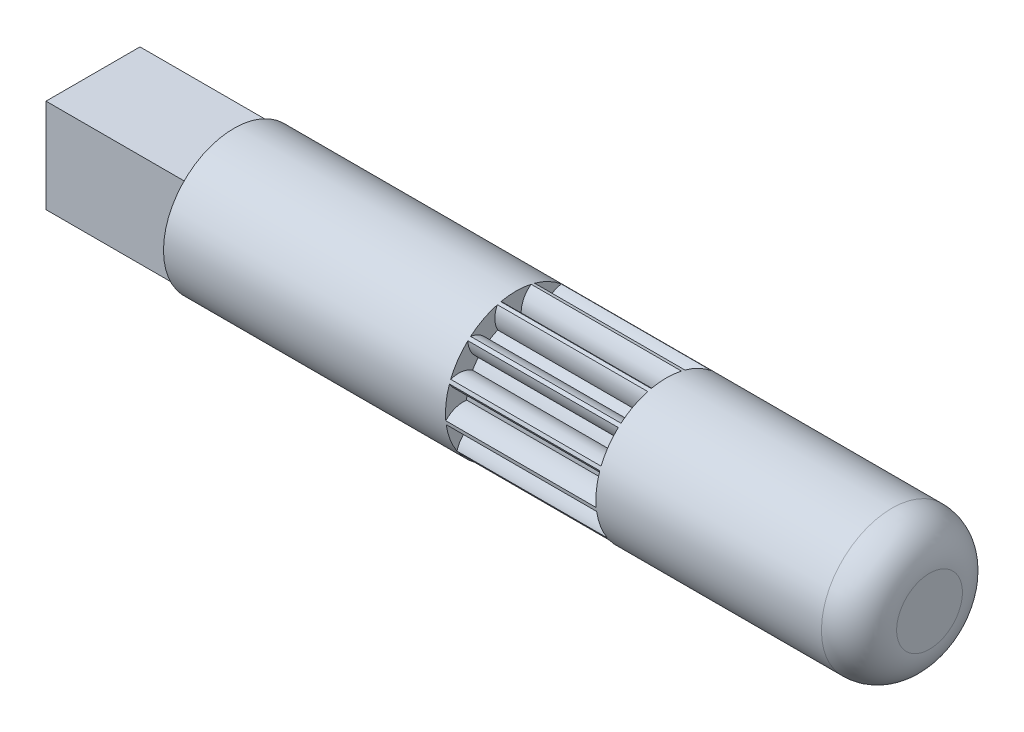
from build123d import *
from build123d.topology import SkipClean

# Parameters (mm, degrees)
BASPROSKE_W         = 8
BASPROSKE_H         = 3.75
TOOTHCUT_DEPTH      = 10.59817691
TEETHCUTS_COUNT     = 13
TEETHCUTS_ANGLE     = 332.307692308
BORSKE_R            = 0.4
BORE_DEPTH          = 50.0000508
SKETCH3_R           = 3.75
BOSS_EXTRUDE3_DEPTH = 15
SKETCH4_W           = 5
SKETCH4_H           = 5
BOSS_EXTRUDE4_DEPTH = 7.5
BOSS_EXTRUDE5_START = 14
SKETCH5_R           = 3.75
BOSS_EXTRUDE5_DEPTH = 14
FILLET1_R           = 2
SKETCH8_R           = 1.303262777
BOSS_EXTRUDE8_DEPTH = 30


with BuildPart() as part:
    # BasProSke → Base-Revolve (revolve)
    with BuildSketch(Plane(origin=(0, 0, 0), x_dir=(1, 0, 0), z_dir=(0, 1, 0))):
        with Locations((4, 1.875)):
            Rectangle(BASPROSKE_W, BASPROSKE_H)
    revolve(axis=Axis((-10, 0, 0), (1, 0, 0)))

    # TooCutSke → ToothCut (cut, through all)
    with BuildSketch(Plane(origin=(0, 0, 0), x_dir=(0, 0, -1), z_dir=(1, 0, 0))):
        with BuildLine():
            ThreePointArc((0.275247387, 2.609523879), (0, 2.624), (-0.275247387, 2.609523879))
            ThreePointArc((-0.275247387, 2.609523879), (-0.421084752, 3.214694797), (-0.831556081, 3.682683756))
            ThreePointArc((-0.831556081, 3.682683756), (0, 3.7754), (0.831556081, 3.682683756))
            ThreePointArc((0.831556081, 3.682683756), (0.421084752, 3.214694797), (0.275247387, 2.609523879))
        make_face()
    toothcut = extrude(amount=TOOTHCUT_DEPTH, mode=Mode.SUBTRACT)

    # TeethCuts: ToothCut ×13 about axis
    teethcuts_axis = Axis((-10, 0, 0), (1, 0, 0))
    for i in range(1, TEETHCUTS_COUNT):
        add(toothcut.rotate(teethcuts_axis, i * TEETHCUTS_ANGLE / (TEETHCUTS_COUNT - 1)), mode=Mode.SUBTRACT)

    # BorSke → Bore (cut, symmetric)
    with BuildSketch(Plane(origin=(0, 0, 0), x_dir=(0, 0, -1), z_dir=(1, 0, 0))):
        Circle(BORSKE_R)
    extrude(amount=BORE_DEPTH, both=True, mode=Mode.SUBTRACT)

    # Sketch3 → Boss-Extrude3 (add)
    with SkipClean():  # the faces are left unmerged after this step: merging them gives an invalid solid
        with BuildSketch(Plane.ZY):
            Circle(SKETCH3_R)
        extrude(amount=BOSS_EXTRUDE3_DEPTH)

    # Sketch4 → Boss-Extrude4 (add)
    with SkipClean():  # the faces are left unmerged after this step: merging them gives an invalid solid
        with BuildSketch(Plane.ZY.offset(15)):
            Rectangle(SKETCH4_W, SKETCH4_H)
        extrude(amount=BOSS_EXTRUDE4_DEPTH)

    # Sketch5 → Boss-Extrude5 (add)
    with BuildSketch(Plane(origin=(8, 0, 0), x_dir=(0, 0, -1), z_dir=(1, 0, 0)).offset(BOSS_EXTRUDE5_START)):
        Circle(SKETCH5_R)
    extrude(amount=-BOSS_EXTRUDE5_DEPTH)

    # Fillet1
    fillet1_edges = [part.edges().sort_by_distance(p)[0] for p in [
        (22, 0, 3.75),
    ]]
    fillet(fillet1_edges, radius=FILLET1_R)

    # Sketch8 → Boss-Extrude8 (add)
    with BuildSketch(Plane(origin=(22, 0, 0), x_dir=(0, 0, -1), z_dir=(1, 0, 0))):
        Circle(SKETCH8_R)
    extrude(amount=-BOSS_EXTRUDE8_DEPTH)


solid = part.part
